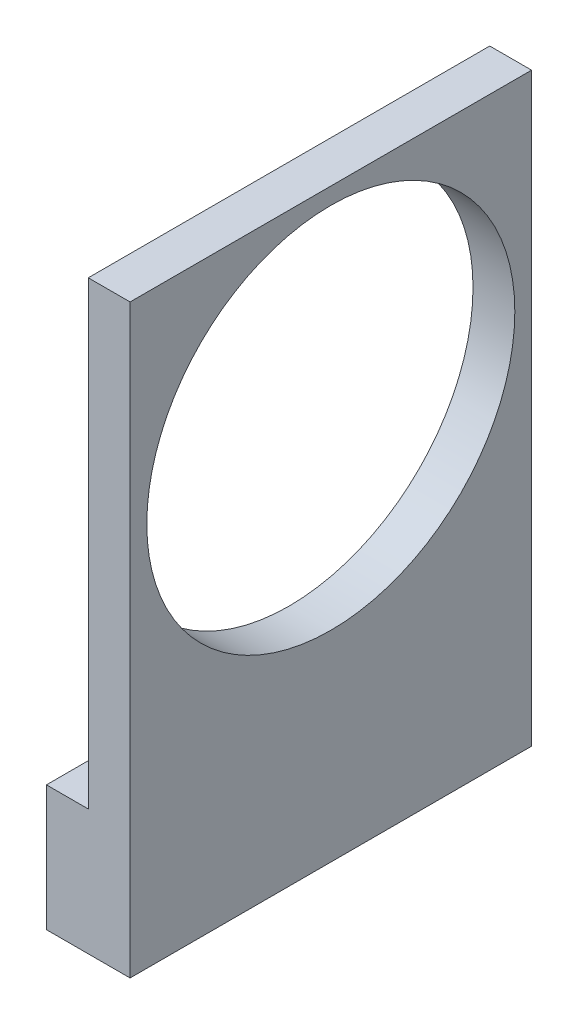
from build123d import *

# Parameters (mm, degrees)
SKETCH4_W                       = 48
SKETCH4_H                       = 70
SKETCH4_R                       = 22
BOSS_EXTRUDE2_DEPTH             = 10
SKETCH5_W                       = 5
SKETCH5_H                       = 55
CUT_EXTRUDE1_DEPTH              = 61.241181927
TAP_DRILL_FOR_M4X0_7_TAP1_D     = 3.3
TAP_DRILL_FOR_M4X0_7_TAP1_DEPTH = 10
TAP_DRILL_FOR_M4X0_7_TAP1_TIP   = 0.991420021


with BuildPart() as part:
    # Sketch4 → Boss-Extrude2 (new body)
    with BuildSketch(Plane(origin=(0, 0, 0), x_dir=(0, 0, -1), z_dir=(1, 0, 0))):
        Rectangle(SKETCH4_W, SKETCH4_H)
        with Locations((0, 11)):
            Circle(SKETCH4_R, mode=Mode.SUBTRACT)
    extrude(amount=BOSS_EXTRUDE2_DEPTH)

    # Sketch5 → Cut-Extrude1 (cut, through all)
    with BuildSketch(Plane(origin=(0, 0, -24), x_dir=(-1, 0, 0), z_dir=(0, 0, -1))):
        with Locations((-2.5, 7.5)):
            Rectangle(SKETCH5_W, SKETCH5_H)
    extrude(amount=-CUT_EXTRUDE1_DEPTH, mode=Mode.SUBTRACT)

    # Tap Drill for M4x0.7 Tap1
    with Locations(Plane(origin=(0, -35, 0), x_dir=(-1, 0, 0), z_dir=(0, -1, 0))):
        with Locations((-5, 19), (-5, -19)):
            Hole(TAP_DRILL_FOR_M4X0_7_TAP1_D / 2, depth=TAP_DRILL_FOR_M4X0_7_TAP1_DEPTH)
            with Locations((0, 0, -(TAP_DRILL_FOR_M4X0_7_TAP1_DEPTH + TAP_DRILL_FOR_M4X0_7_TAP1_TIP / 2))):  # 118° drill point
                Cone(0, TAP_DRILL_FOR_M4X0_7_TAP1_D / 2, TAP_DRILL_FOR_M4X0_7_TAP1_TIP, mode=Mode.SUBTRACT)


solid = part.part
